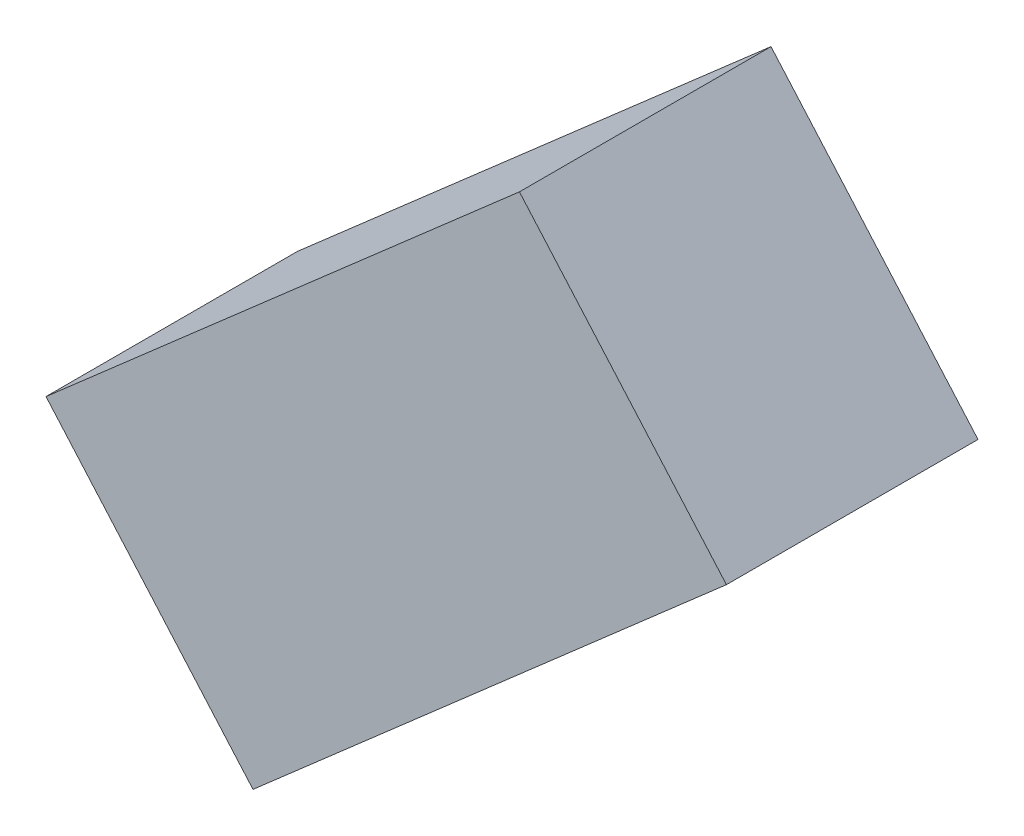
from build123d import *

# Parameters (mm, degrees)
EXTRUDE_1_DEPTH = 8


with BuildPart() as part:
    # 草图1 → 凸台-拉伸1 (new body)
    with BuildSketch(Plane.XY):
        Polygon((-49.792206999, 68.914076653), (-64.847976423, 55.748826673), (-58.265351433, 48.220941961), (-43.209582009, 61.386191941), align=None)
    extrude(amount=EXTRUDE_1_DEPTH)


solid = part.part
